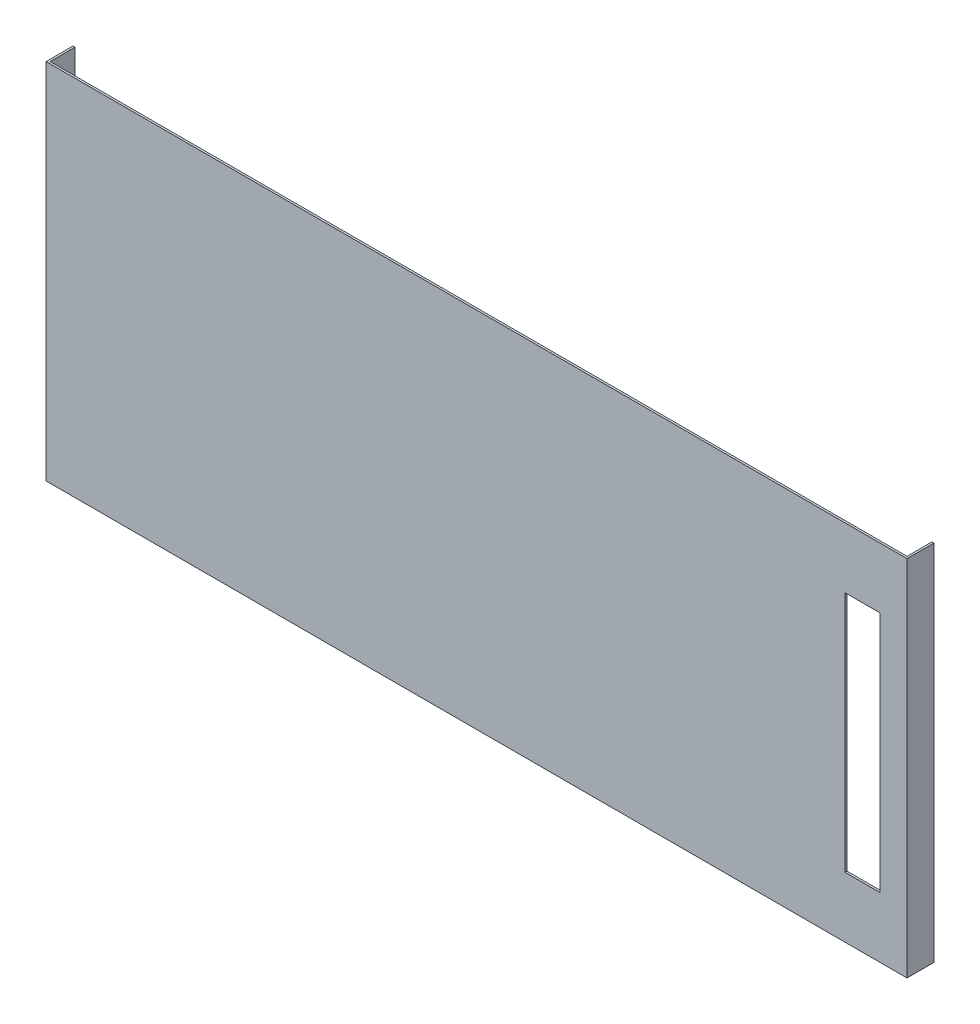
from build123d import *

# Parameters (mm, degrees)
OVEN_FAN_FILTRE_KAPAGI_KAPAK_1_START = 1680
OVEN_FAN_FILTRE_KAPAGI_KAPAK_1_DEPTH = 270
OVEN_FAN_FILTRE_KAPAGI_KAPAK_2_START = 27
SKETCH2_W                            = 26
SKETCH2_H                            = 180
OVEN_FAN_FILTRE_KAPAGI_KAPAK_2_DEPTH = 14


with BuildPart() as part:
    # Sketch1 → OVEN_fan_filtre_kapagi_kapak_1 (new body)
    with BuildSketch(Plane(origin=(0, 0, 0), x_dir=(1, 0, 0), z_dir=(0, 1, 0)).offset(OVEN_FAN_FILTRE_KAPAGI_KAPAK_1_START)):
        Polygon((30, -40), (30, -20), (31.5, -20), (31.5, -38.5), (668.5, -38.5), (668.5, -20), (670, -20), (670, -40), align=None)
    extrude(amount=OVEN_FAN_FILTRE_KAPAGI_KAPAK_1_DEPTH)

    # Sketch2 → OVEN_fan_filtre_kapagi_kapak_2 (cut)
    with BuildSketch(Plane.XY.offset(OVEN_FAN_FILTRE_KAPAGI_KAPAK_2_START)):
        with Locations((637, 1815)):
            Rectangle(SKETCH2_W, SKETCH2_H)
    extrude(amount=OVEN_FAN_FILTRE_KAPAGI_KAPAK_2_DEPTH, mode=Mode.SUBTRACT)


solid = part.part
